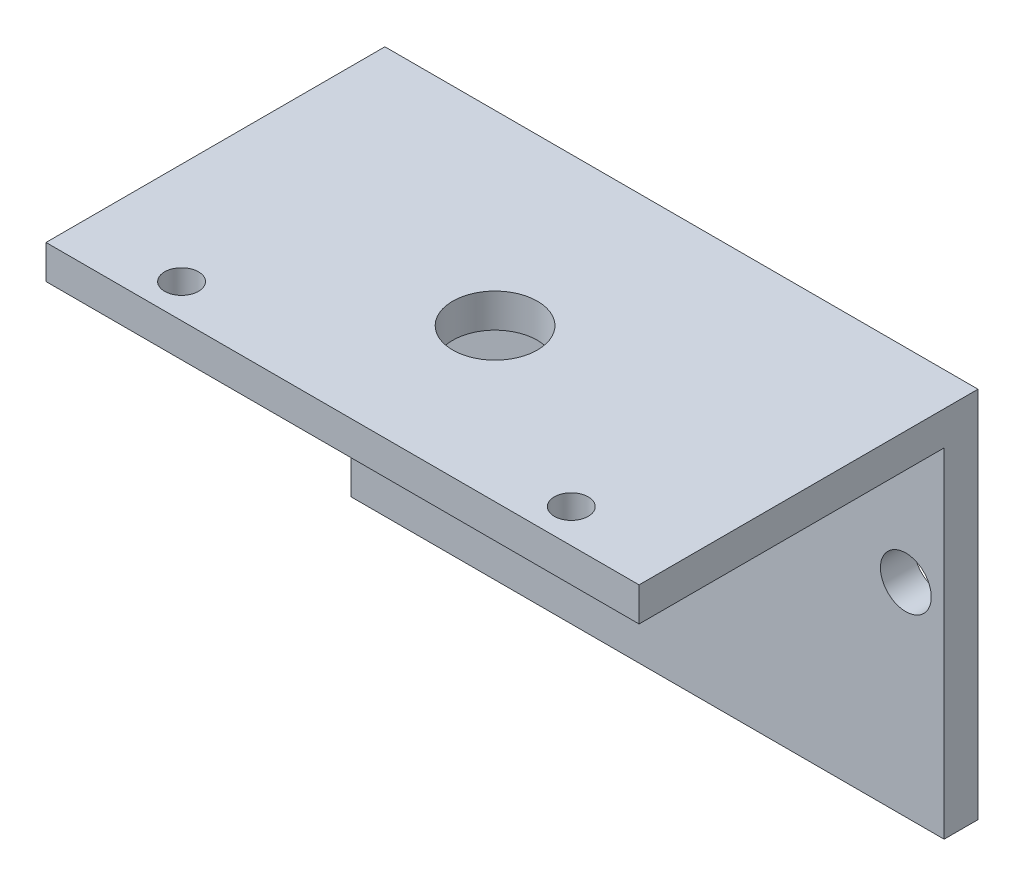
from build123d import *

# Parameters (mm, degrees)
SKETCH1_W           = 35
SKETCH1_H           = 20
BOSS_EXTRUDE1_DEPTH = 2
SKETCH2_W           = 35
SKETCH2_H           = 2
BOSS_EXTRUDE2_DEPTH = 20
SKETCH3_R           = 1.5
CUT_EXTRUDE1_DEPTH  = 20
SKETCH4_R           = 1
CUT_EXTRUDE2_DEPTH  = 20
SKETCH6_R           = 2.5
CUT_EXTRUDE3_DEPTH  = 20


with BuildPart() as part:
    # Sketch1 → Boss-Extrude1 (new body)
    with BuildSketch(Plane(origin=(0, 0, 0), x_dir=(1, 0, 0), z_dir=(0, 1, 0))):
        Rectangle(SKETCH1_W, SKETCH1_H)
    extrude(amount=BOSS_EXTRUDE1_DEPTH)

    # Sketch2 → Boss-Extrude2 (add)
    with BuildSketch(Plane.XZ):
        with Locations((0, -9)):
            Rectangle(SKETCH2_W, SKETCH2_H)
    extrude(amount=BOSS_EXTRUDE2_DEPTH)

    # Sketch3 → Cut-Extrude1 (cut)
    with BuildSketch(Plane(origin=(0, 0, -10), x_dir=(-1, 0, 0), z_dir=(0, 0, -1))):
        with Locations((-15.240565198, -8)):
            Circle(SKETCH3_R)
        with Locations((15.443232288, -8)):
            Circle(SKETCH3_R)
    extrude(amount=-CUT_EXTRUDE1_DEPTH, mode=Mode.SUBTRACT)

    # Sketch4 → Cut-Extrude2 (cut)
    with BuildSketch(Plane.XZ):
        with Locations(Location((-11.5, 8, 0), (0, 0, 270))):
            Circle(SKETCH4_R)
        with Locations(Location((11.5, 8, 0), (0, 0, 270))):
            Circle(SKETCH4_R)
    extrude(amount=-CUT_EXTRUDE2_DEPTH, mode=Mode.SUBTRACT)

    # Sketch6 → Cut-Extrude3 (cut)
    with BuildSketch(Plane.XZ):
        with Locations(Location((0, 1, 0), (0, 0, 270))):
            Circle(SKETCH6_R)
    extrude(amount=-CUT_EXTRUDE3_DEPTH, mode=Mode.SUBTRACT)


solid = part.part
